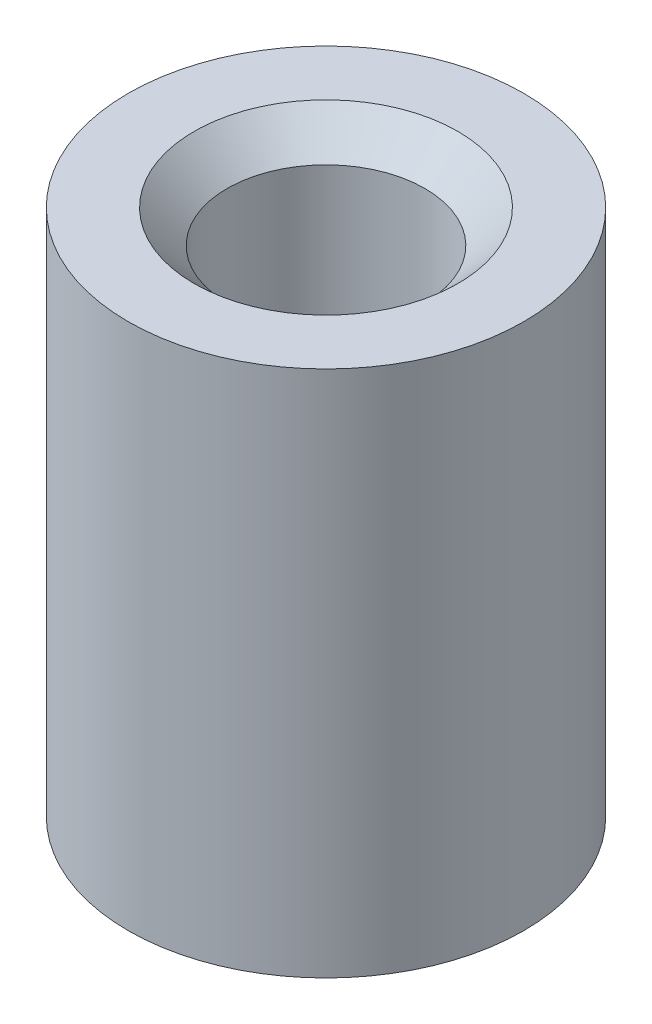
from build123d import *

# Parameters (mm, degrees)
SKETCH1_W     = 3
SKETCH1_H     = 16
CHAMFER1_SIZE = 1


with BuildPart() as part:
    # Sketch1 → Revolve1 (revolve)
    with BuildSketch(Plane.XY, mode=Mode.PRIVATE) as revolve1_sk:
        with Locations((4.5, 8)):
            Rectangle(SKETCH1_W, SKETCH1_H)
    revolve(revolve1_sk.sketch.rotate(Axis((0, 0, 0), (0, 1, 0)), 90), axis=Axis((0, 0, 0), (0, 1, 0)))

    # Chamfer1
    chamfer1_edges = [part.edges().sort_by_distance(p)[0] for p in [
        (0, 16, 3),
    ]]
    chamfer(chamfer1_edges, length=CHAMFER1_SIZE)


solid = part.part
